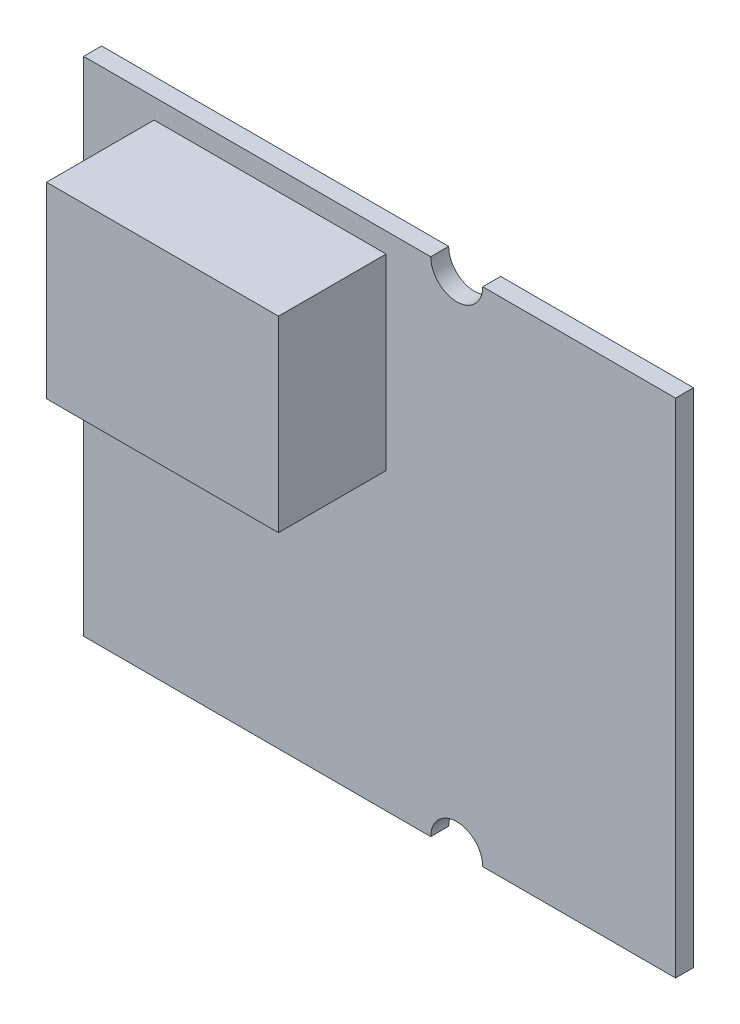
from build123d import *

# Parameters (mm, degrees)
EXTRUDE_1_DEPTH = 1
SKETCH_2_W      = 12.935520023
SKETCH_2_H      = 10.454735361
EXTRUDE_2_DEPTH = 6


with BuildPart() as part:
    # Эскиз1 → Бобышка-Вытянуть1 (new body)
    with BuildSketch(Plane.XY):
        with BuildLine():
            Line((0, 0), (19.35, 0))
            ThreePointArc((19.35, 0), (20.8, 1.45), (22.25, 0))
            Line((22.25, 0), (33, 0))
            Line((33, 0), (33, 28))
            Line((33, 28), (22.25, 28))
            ThreePointArc((22.25, 28), (20.8, 26.55), (19.35, 28))
            Line((19.35, 28), (0, 28))
            Line((0, 28), (0, 15.45))
            ThreePointArc((0, 15.45), (1.45, 14), (0, 12.55))
            Line((0, 12.55), (0, 0))
        make_face()
    extrude(amount=EXTRUDE_1_DEPTH)

    # Эскиз2 → Бобышка-Вытянуть2 (add)
    with BuildSketch(Plane.XY.offset(1)):
        with Locations((10.395518043, 21.660261576)):
            Rectangle(SKETCH_2_W, SKETCH_2_H)
    extrude(amount=EXTRUDE_2_DEPTH)


solid = part.part
